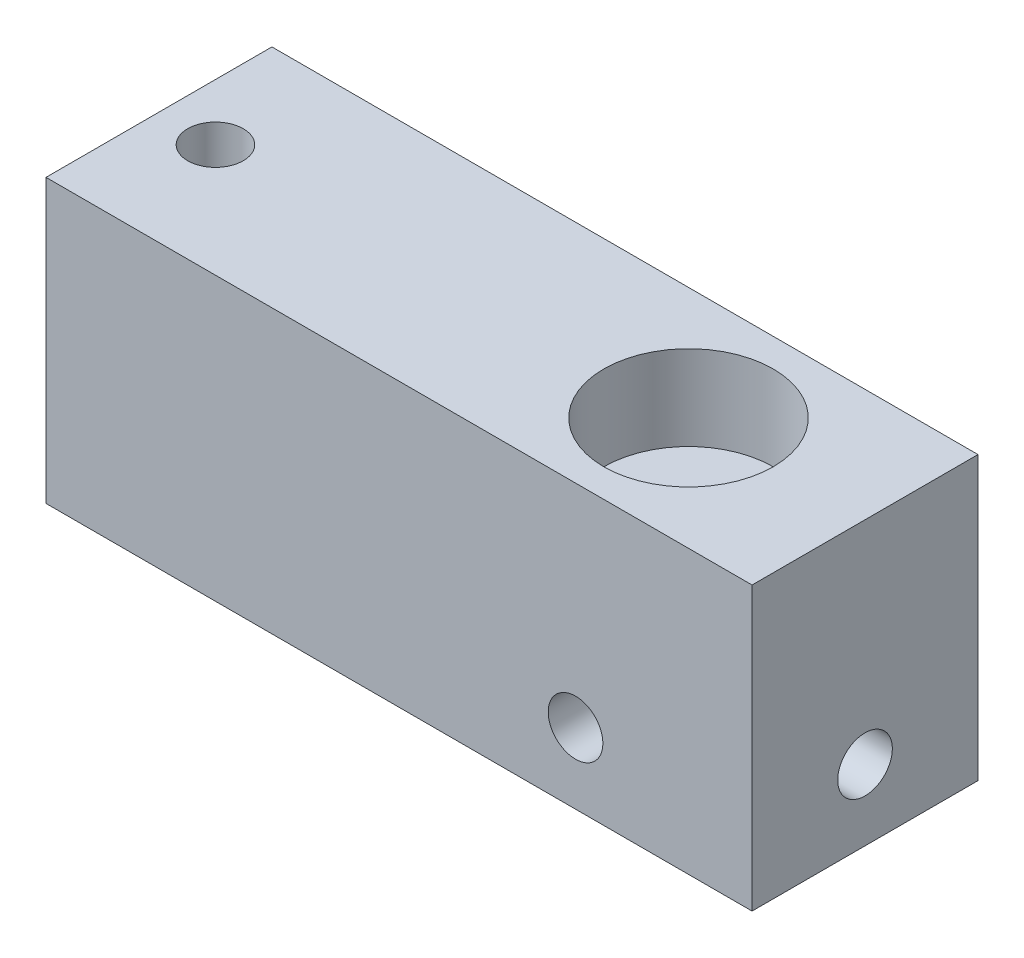
from build123d import *

# Parameters (mm, degrees)
SKETCH1_W                        = 63.5
SKETCH1_H                        = 25.4
BOSS_EXTRUDE1_DEPTH              = 20.32
F_10_0_1935_DIAMETER_HOLE1_D     = 4.9149
F_10_0_1935_DIAMETER_HOLE1_DEPTH = 15.875
F_10_0_1935_DIAMETER_HOLE1_TIP   = 1.476584928
F_10_0_1935_DIAMETER_HOLE2_D     = 4.9149
F_10_0_1935_DIAMETER_HOLE2_DEPTH = 10.16
F_10_0_1935_DIAMETER_HOLE2_TIP   = 1.476584928
SKETCH6_R                        = 3.175
CUT_EXTRUDE1_DEPTH               = 59.427173695
SKETCH7_R                        = 7.62
CUT_EXTRUDE2_DEPTH               = 7.62
TAP_DRILL_FOR_M6X1_0_TAP1_D      = 5
TAP_DRILL_FOR_M6X1_0_TAP1_DEPTH  = 16.002
TAP_DRILL_FOR_M6X1_0_TAP1_TIP    = 1.502151548


with BuildPart() as part:
    # Sketch1 → Boss-Extrude1 (new body)
    with BuildSketch(Plane.XY):
        with Locations((-16.785267857, -8.961160714)):
            Rectangle(SKETCH1_W, SKETCH1_H)
    extrude(amount=BOSS_EXTRUDE1_DEPTH)

    # #10 (0.1935) Diameter Hole1
    with Locations(Plane(origin=(14.964732143, 0, 0), x_dir=(0, 0, -1), z_dir=(1, 0, 0))):
        with Locations((-10.16, -15.311160714)):
            Hole(F_10_0_1935_DIAMETER_HOLE1_D / 2, depth=F_10_0_1935_DIAMETER_HOLE1_DEPTH)
            with Locations((0, 0, -(F_10_0_1935_DIAMETER_HOLE1_DEPTH + F_10_0_1935_DIAMETER_HOLE1_TIP / 2))):  # 118° drill point
                Cone(0, F_10_0_1935_DIAMETER_HOLE1_D / 2, F_10_0_1935_DIAMETER_HOLE1_TIP, mode=Mode.SUBTRACT)

    # #10 (0.1935) Diameter Hole2
    with Locations(Plane.XY.offset(20.32)):
        with Locations((-0.910267857, -15.311160714)):
            Hole(F_10_0_1935_DIAMETER_HOLE2_D / 2, depth=F_10_0_1935_DIAMETER_HOLE2_DEPTH)
            with Locations((0, 0, -(F_10_0_1935_DIAMETER_HOLE2_DEPTH + F_10_0_1935_DIAMETER_HOLE2_TIP / 2))):  # 118° drill point
                Cone(0, F_10_0_1935_DIAMETER_HOLE2_D / 2, F_10_0_1935_DIAMETER_HOLE2_TIP, mode=Mode.SUBTRACT)

    # Sketch6 → Cut-Extrude1 (cut, through all)
    with BuildSketch(Plane(origin=(0, -21.661160714, 0), x_dir=(-1, 0, 0), z_dir=(0, -1, 0))):
        with Locations(Location((0.910267857, -10.16, 0), (0, 0, 90))):
            Circle(SKETCH6_R)
    extrude(amount=-CUT_EXTRUDE1_DEPTH, mode=Mode.SUBTRACT)

    # Sketch7 → Cut-Extrude2 (cut)
    with BuildSketch(Plane(origin=(0, 3.738839286, 0), x_dir=(1, 0, 0), z_dir=(0, 1, 0))):
        with Locations(Location((-0.910267857, -10.16, 0), (0, 0, 270))):
            Circle(SKETCH7_R)
    extrude(amount=-CUT_EXTRUDE2_DEPTH, mode=Mode.SUBTRACT)

    # Tap Drill for M6x1.0 Tap1
    with Locations(Plane(origin=(0, 3.738839286, 0), x_dir=(1, 0, 0), z_dir=(0, 1, 0))):
        with Locations((-43.455267857, -10.16)):
            Hole(TAP_DRILL_FOR_M6X1_0_TAP1_D / 2, depth=TAP_DRILL_FOR_M6X1_0_TAP1_DEPTH)
            with Locations((0, 0, -(TAP_DRILL_FOR_M6X1_0_TAP1_DEPTH + TAP_DRILL_FOR_M6X1_0_TAP1_TIP / 2))):  # 118° drill point
                Cone(0, TAP_DRILL_FOR_M6X1_0_TAP1_D / 2, TAP_DRILL_FOR_M6X1_0_TAP1_TIP, mode=Mode.SUBTRACT)


solid = part.part
